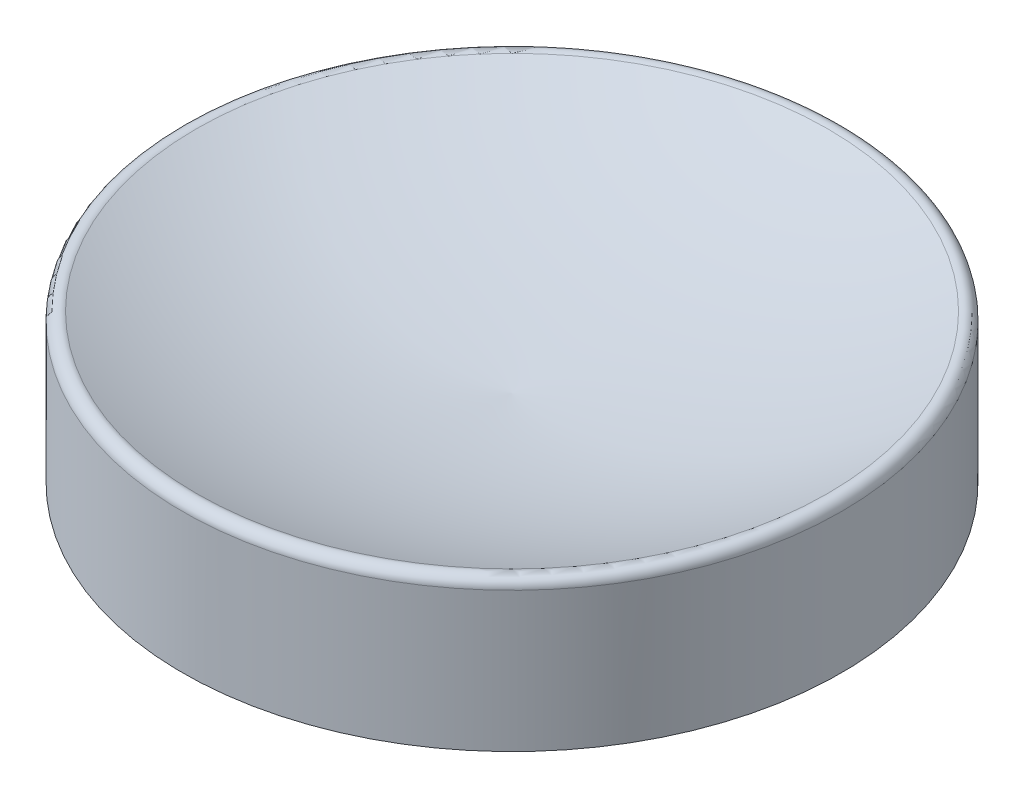
from build123d import *

# Parameters (mm, degrees)
FILLET1_R           = 0.25
SKETCH2_R           = 3
BOSS_EXTRUDE1_DEPTH = 2


with BuildPart() as part:
    # Sketch1 → Revolve1 (revolve)
    with BuildSketch(Plane.XY, mode=Mode.PRIVATE) as revolve1_sk:
        with BuildLine():
            Line((0, 2), (0, 0))
            Line((0, 0), (8.5, 0))
            Line((8.5, 0), (8.5, 4))
            add(Edge.make_bspline(
                [(0, 2), (2.747861556, 2.169330532), (5.476127383, 2.511075109), (8.5, 4)],
                knots=[0, 0, 0, 0, 1, 1, 1, 1], degree=3))
        make_face()
    revolve(revolve1_sk.sketch.rotate(Axis((0, 2, 0), (0, -1, 0)), 180), axis=Axis((0, 2, 0), (0, -1, 0)))

    # Fillet1
    fillet1_edges = [part.edges().sort_by_distance(p)[0] for p in [
        (8.5, 4, 0),
    ]]
    fillet(fillet1_edges, radius=FILLET1_R)

    # Sketch2 → Boss-Extrude1 (add)
    with BuildSketch(Plane.XZ):
        Circle(SKETCH2_R)
    extrude(amount=BOSS_EXTRUDE1_DEPTH)


solid = part.part
